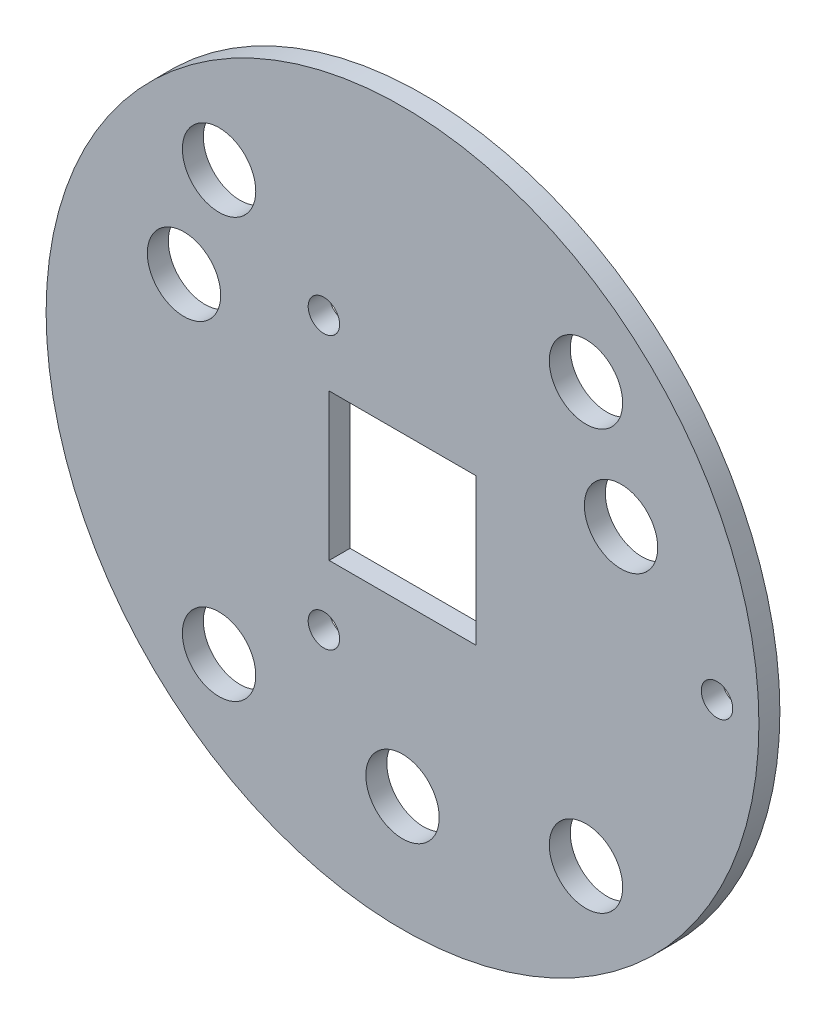
from build123d import *

# Parameters (mm, degrees)
SKETCH1_R           = 34
SKETCH1_R_2         = 1.5
SKETCH1_R_3         = 3.5
SKETCH1_W           = 14
SKETCH1_H           = 14
BOSS_EXTRUDE1_DEPTH = 2


with BuildPart() as part:
    # Sketch1 → Boss-Extrude1 (new body)
    with BuildSketch(Plane.XY):
        Circle(SKETCH1_R)
        with Locations((30, 0)):
            Circle(SKETCH1_R_2, mode=Mode.SUBTRACT)
        with Locations((-7.5, -12.990381057)):
            Circle(SKETCH1_R_2, mode=Mode.SUBTRACT)
        with Locations((-7.5, 12.990381057)):
            Circle(SKETCH1_R_2, mode=Mode.SUBTRACT)
        with Locations((-17.5, 20)):
            Circle(SKETCH1_R_3, mode=Mode.SUBTRACT)
        with Locations(Location((17.5, 20, 0), (0, 0, 180))):
            Circle(SKETCH1_R_3, mode=Mode.SUBTRACT)
        with Locations(Location((-17.5, -20, 0), (0, 0, 180))):
            Circle(SKETCH1_R_3, mode=Mode.SUBTRACT)
        with Locations((17.5, -20)):
            Circle(SKETCH1_R_3, mode=Mode.SUBTRACT)
        with Locations((20.845079102, 9.72022002)):
            Circle(SKETCH1_R_3, mode=Mode.SUBTRACT)
        with Locations((0, -23)):
            Circle(SKETCH1_R_3, mode=Mode.SUBTRACT)
        with Locations((-20.845079102, 9.72022002)):
            Circle(SKETCH1_R_3, mode=Mode.SUBTRACT)
        Rectangle(SKETCH1_W, SKETCH1_H, mode=Mode.SUBTRACT)
    extrude(amount=BOSS_EXTRUDE1_DEPTH)


solid = part.part
